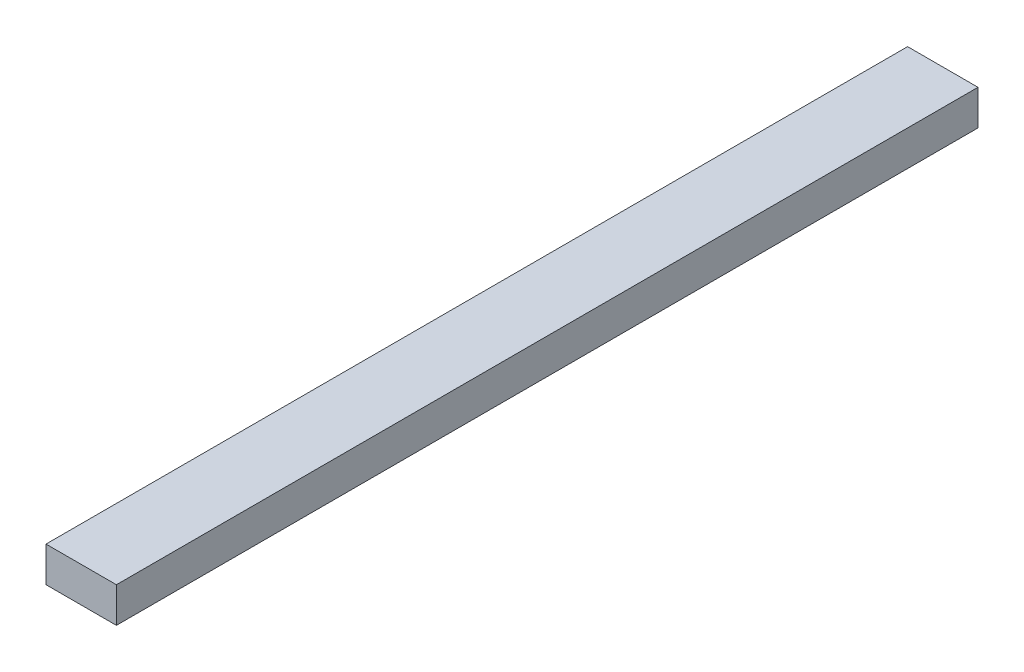
from build123d import *

# Parameters (mm, degrees)
SKETCH1_W           = 50.8
SKETCH1_H           = 25.4
BOSS_EXTRUDE1_DEPTH = 609.6
SKETCH2_W           = 50.8
SKETCH2_H           = 25.4
BOSS_EXTRUDE2_DEPTH = 12


with BuildPart() as part:
    # Sketch1 → Boss-Extrude1 (new body)
    with BuildSketch(Plane.XY):
        Rectangle(SKETCH1_W, SKETCH1_H)
    extrude(amount=BOSS_EXTRUDE1_DEPTH)

    # Sketch2 → Boss-Extrude2 (add)
    with BuildSketch(Plane.XY.offset(609.6)):
        Rectangle(SKETCH2_W, SKETCH2_H)
    extrude(amount=BOSS_EXTRUDE2_DEPTH)


solid = part.part
